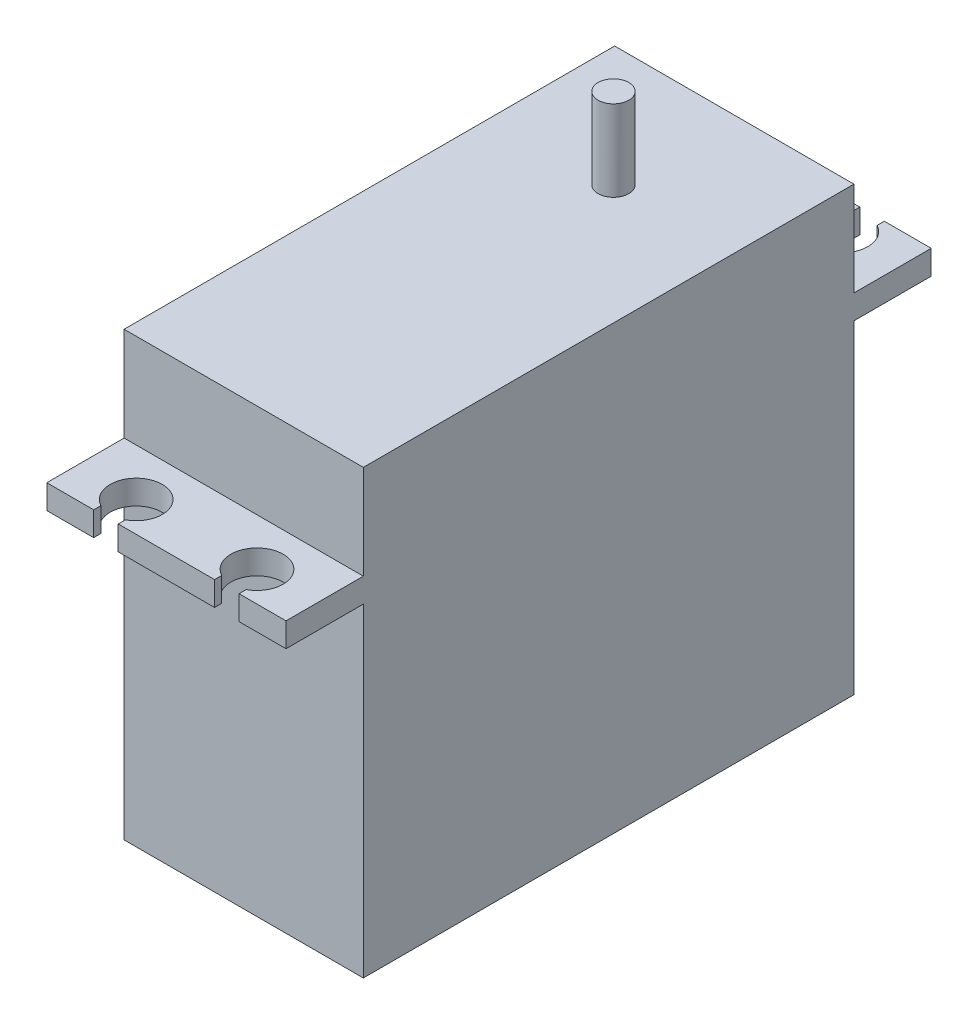
from build123d import *

# Parameters (mm, degrees)
SKETCH1_W           = 19.8
SKETCH1_H           = 40.6
BOSS_EXTRUDE1_DEPTH = 36.6
SKETCH2_R           = 1.27
BOSS_EXTRUDE2_DEPTH = 6.700000022
SKETCH3_W           = 19.8
SKETCH3_H           = 2
BOSS_EXTRUDE3_DEPTH = 6.4
SKETCH4_W           = 19.8
SKETCH4_H           = 2
BOSS_EXTRUDE4_DEPTH = 6.4
CUT_EXTRUDE1_DEPTH  = 47.37305252


with BuildPart() as part:
    # Sketch1 → Boss-Extrude1 (new body)
    with BuildSketch(Plane(origin=(0, 0, 0), x_dir=(1, 0, 0), z_dir=(0, 1, 0))):
        Rectangle(SKETCH1_W, SKETCH1_H)
    extrude(amount=BOSS_EXTRUDE1_DEPTH)

    # Sketch2 → Boss-Extrude2 (add)
    with BuildSketch(Plane(origin=(0, 36.6, 0), x_dir=(1, 0, 0), z_dir=(0, 1, 0))):
        with Locations(Location((0, 10.3, 0), (0, 0, 90))):
            Circle(SKETCH2_R)
    extrude(amount=BOSS_EXTRUDE2_DEPTH)

    # Sketch3 → Boss-Extrude3 (add)
    with BuildSketch(Plane(origin=(0, 0, -20.3), x_dir=(-1, 0, 0), z_dir=(0, 0, -1))):
        with Locations((0, 27.8)):
            Rectangle(SKETCH3_W, SKETCH3_H)
    extrude(amount=BOSS_EXTRUDE3_DEPTH)

    # Sketch4 → Boss-Extrude4 (add)
    with BuildSketch(Plane.XY.offset(20.3)):
        with Locations((0, 27.8)):
            Rectangle(SKETCH4_W, SKETCH4_H)
    extrude(amount=BOSS_EXTRUDE4_DEPTH)

    # Sketch5 → Cut-Extrude1 (cut, through all)
    with BuildSketch(Plane(origin=(0, 36.6, 0), x_dir=(1, 0, 0), z_dir=(0, 1, 0))):
        with BuildLine():
            Line((-6.016, 26.105), (-6.016, 26.7))
            Line((-6.016, 26.7), (-3.984, 26.7))
            Line((-3.984, 26.7), (-3.984, 26.105))
            ThreePointArc((-3.984, 26.105), (-5, 22.041), (-6.016, 26.105))
        make_face()
        with BuildLine():
            Line((3.984, 26.105), (3.984, 26.7))
            Line((3.984, 26.7), (6.016, 26.7))
            Line((6.016, 26.7), (6.016, 26.105))
            ThreePointArc((6.016, 26.105), (5, 22.041), (3.984, 26.105))
        make_face()
        with BuildLine():
            Line((-6.016, -26.105), (-6.016, -26.7))
            Line((-6.016, -26.7), (-3.984, -26.7))
            Line((-3.984, -26.7), (-3.984, -26.105))
            ThreePointArc((-3.984, -26.105), (-5, -22.041), (-6.016, -26.105))
        make_face()
        with BuildLine():
            Line((3.984, -26.105), (3.984, -26.7))
            Line((3.984, -26.7), (6.016, -26.7))
            Line((6.016, -26.7), (6.016, -26.105))
            ThreePointArc((6.016, -26.105), (5, -22.041), (3.984, -26.105))
        make_face()
    extrude(amount=-CUT_EXTRUDE1_DEPTH, mode=Mode.SUBTRACT)


solid = part.part
